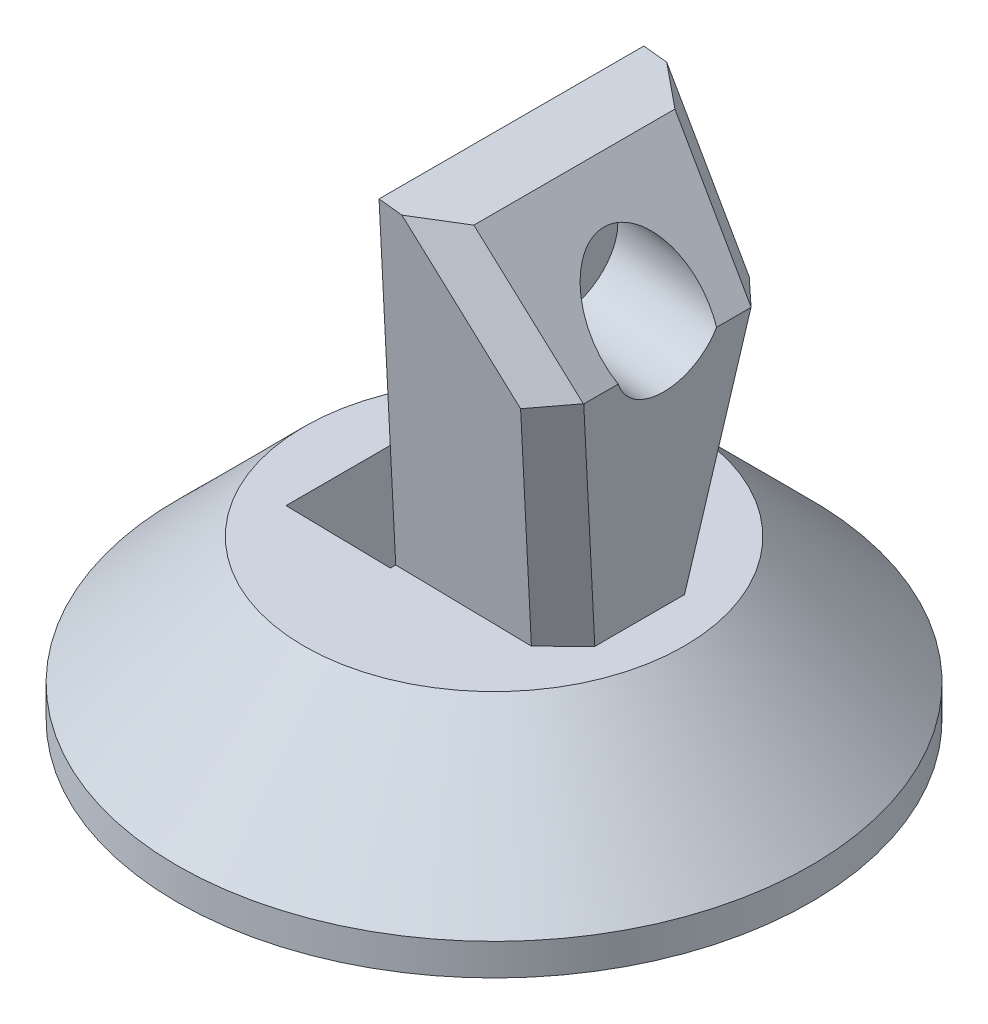
from build123d import *
from OCP.BRepFilletAPI import BRepFilletAPI_MakeChamfer

# Parameters (mm, degrees)
CUT_EXTRUDE1_START  = -4
CUT_EXTRUDE1_DEPTH  = 10
BOSS_EXTRUDE1_DEPTH = 16
CHAMFER3_SIZE       = 10
CHAMFER1_SIZE       = 3
CHAMFER1_SIZE2      = 2.716212543
SKETCH4_R           = 1.75
CUT_EXTRUDE2_DEPTH  = 11
SKETCH5_R           = 1.5
CUT_EXTRUDE3_DEPTH  = 73.60961678
SKETCH6_R           = 5
CUT_EXTRUDE4_DEPTH  = 10


with BuildPart() as part:
    # Sketch1 → Revolve1 (revolve)
    with BuildSketch(Plane.XY):
        Polygon((-30, 0), (-30, 3), (-18, 15), (0, 15), (0, 0), align=None)
    revolve(axis=Axis((0, 15, 0), (0, -1, 0)))

    # Sketch2 → Cut-Extrude1 (cut)
    with BuildSketch(Plane(origin=(0, 0, 0), x_dir=(0, 0, 1), z_dir=(0.9935718556765875, -0.11320321376790697, 0)).offset(CUT_EXTRUDE1_START)):
        Polygon((7.866459251, -16.941235683), (5.5, -2), (-5.5, -2), (-7.866459251, -16.941235683), align=None)
    extrude(amount=-CUT_EXTRUDE1_DEPTH, mode=Mode.SUBTRACT)

    # Sketch3 → Boss-Extrude1 (add)
    with BuildSketch(Plane(origin=(-3.974287423, 0.452812855, 0), x_dir=(0, 0, 1), z_dir=(-0.9935718556765875, 0.11320321376790698, 0))):
        Polygon((-6.995953226, 14.641303557), (-12.539408637, 49.641303557), (12.539408637, 49.641303557), (6.995953226, 14.641303557), align=None)
    extrude(amount=-BOSS_EXTRUDE1_DEPTH)

    # Chamfer3
    chamfer3_edges = [part.edges().sort_by_distance(p)[0] for p in [
        (17.542417366, 47.963763528, 0),
    ]]
    chamfer(chamfer3_edges, length=CHAMFER3_SIZE)

    # Chamfer1: one chamfer whose edges measure the first distance from different faces: ONE call of the kernel's chamfer builder (chamfer() names one face for all edges)
    chamfer1_edges_1 = [part.edges().sort_by_distance(p)[0] for p in [
        (15.098528073, 26.514022486, -9.12012375),
        (15.098528073, 26.514022486, 9.12012375),
    ]]
    chamfer1_edges_2 = [part.edges().sort_by_distance(p)[0] for p in [
        (12.008542019, 43.561920319, -11.747486436),
        (12.008542019, 43.561920319, 11.747486436),
    ]]
    chamfer1_side_2 = [part.faces().sort_by_distance(p)[0] for p in [
        (11.909629587, 43.686270289, 0),
    ]]
    chamfer1 = BRepFilletAPI_MakeChamfer(part.part.solid().wrapped)
    for e in chamfer1_edges_1:
        chamfer1.Add(CHAMFER1_SIZE, e.wrapped)
    for e in chamfer1_edges_2:
        chamfer1.Add(CHAMFER1_SIZE, CHAMFER1_SIZE2, e.wrapped, chamfer1_side_2[0].wrapped)  # the first distance lies on this face
    add(Compound.cast(chamfer1.Shape()), mode=Mode.REPLACE)

    # Sketch4 → Cut-Extrude2 (cut)
    with BuildSketch(Plane.XZ):
        with Locations((-16, 0)):
            Circle(SKETCH4_R)
        with Locations((16, 0)):
            Circle(SKETCH4_R)
    extrude(amount=-CUT_EXTRUDE2_DEPTH, mode=Mode.SUBTRACT)

    # Sketch5 → Cut-Extrude3 (cut, through all)
    with BuildSketch(Plane(origin=(11.922862268, -1.358438565, 0), x_dir=(0, 0, -1), z_dir=(0.9935718556765875, -0.11320321376790698, 0))):
        with Locations((0, 41.46427329)):
            Circle(SKETCH5_R)
    extrude(amount=-CUT_EXTRUDE3_DEPTH, mode=Mode.SUBTRACT)

    # Sketch6 → Cut-Extrude4 (cut)
    with BuildSketch(Plane(origin=(11.922862268, -1.358438565, 0), x_dir=(0, 0, -1), z_dir=(0.9935718556765875, -0.11320321376790698, 0))):
        with Locations((0, 41.46427329)):
            Circle(SKETCH6_R)
    extrude(amount=-CUT_EXTRUDE4_DEPTH, mode=Mode.SUBTRACT)


solid = part.part
